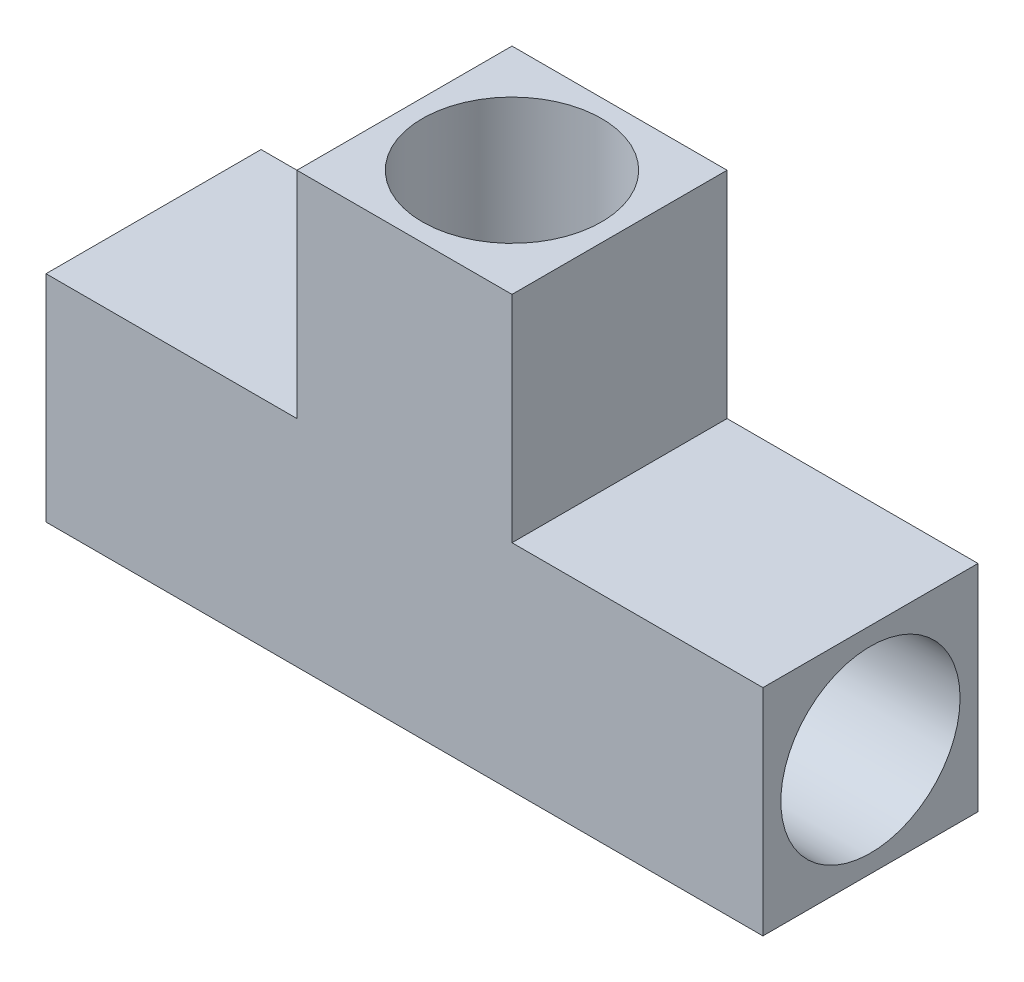
from build123d import *

# Parameters (mm, degrees)
EXTRUDE_3_DEPTH     = 15
SKETCH_6_R          = 12.5
CUT_EXTRUDE_3_DEPTH = 100
SKETCH_7_R          = 12.5
CUT_EXTRUDE_4_DEPTH = 45


with BuildPart() as part:
    # 草图5 → 凸台-拉伸3 (new, symmetric)
    with BuildSketch(Plane.XY):
        Polygon((15, 15), (50, 15), (50, -15), (-50, -15), (-50, 15), (-15, 15), (-15, 45), (15, 45), align=None)
    extrude(amount=EXTRUDE_3_DEPTH, both=True)

    # 草图6 → 切除-拉伸3 (cut)
    with BuildSketch(Plane(origin=(50, 0, 0), x_dir=(0, 0, -1), z_dir=(1, 0, 0))):
        Circle(SKETCH_6_R)
    extrude(amount=-CUT_EXTRUDE_3_DEPTH, mode=Mode.SUBTRACT)

    # 草图7 → 切除-拉伸4 (cut)
    with BuildSketch(Plane(origin=(0, 45, 0), x_dir=(1, 0, 0), z_dir=(0, 1, 0))):
        with Locations(Location((0, 0, 0), (0, 0, 270))):
            Circle(SKETCH_7_R)
    extrude(amount=-CUT_EXTRUDE_4_DEPTH, mode=Mode.SUBTRACT)


solid = part.part
